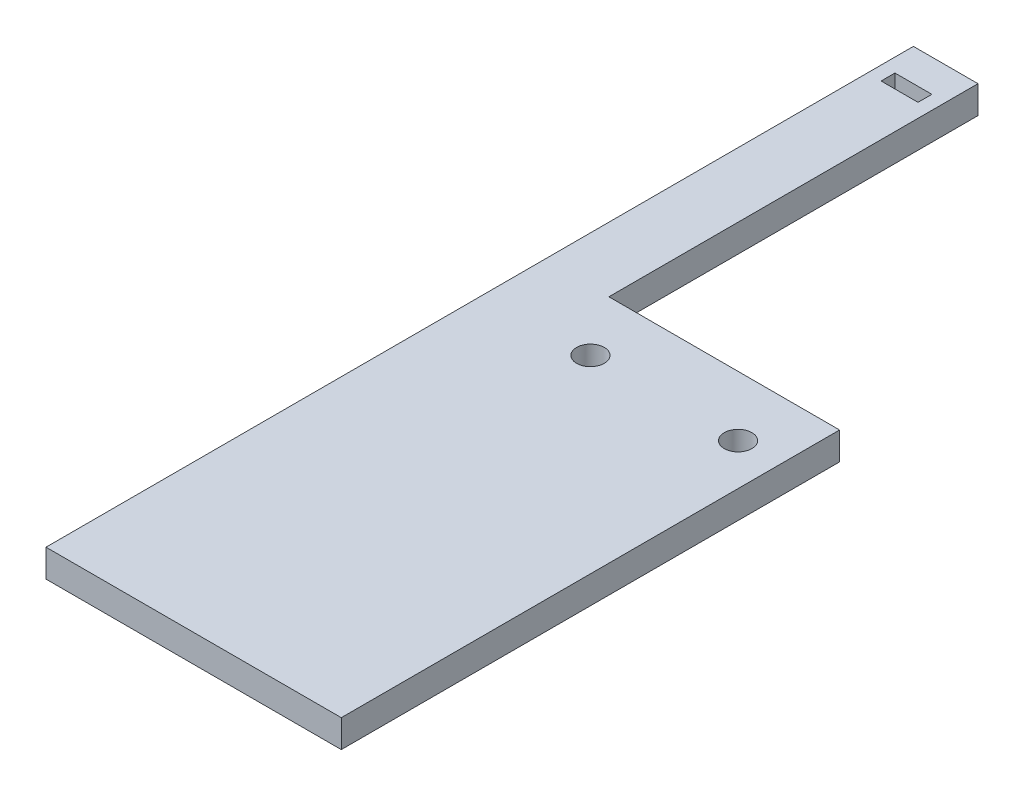
from build123d import *

# Parameters (mm, degrees)
SKETCH1_W           = 4
SKETCH1_H           = 1.5
BOSS_EXTRUDE1_DEPTH = 3
SKETCH3_W           = 12
SKETCH3_H           = 3
CUT_EXTRUDE2_DEPTH  = 104.831594421
SKETCH6_R           = 1.5
CUT_EXTRUDE4_DEPTH  = 10


with BuildPart() as part:
    # Sketch1 → Boss-Extrude1 (new body)
    with BuildSketch(Plane(origin=(0, 0, 0), x_dir=(1, 0, 0), z_dir=(0, 1, 0))):
        Polygon((0, 54), (0, 94), (7, 94), (7, 54), (44, 54), (44, 0), (0, 0), align=None)
        with Locations((3.5, 89.75)):
            Rectangle(SKETCH1_W, SKETCH1_H, mode=Mode.SUBTRACT)
    extrude(amount=BOSS_EXTRUDE1_DEPTH)

    # Sketch3 → Cut-Extrude2 (cut, through all)
    with BuildSketch(Plane.XY):
        with Locations((38, 1.5)):
            Rectangle(SKETCH3_W, SKETCH3_H)
    extrude(amount=-CUT_EXTRUDE2_DEPTH, mode=Mode.SUBTRACT)

    # Sketch6 → Cut-Extrude4 (cut)
    with BuildSketch(Plane(origin=(0, 3, 0), x_dir=(1, 0, 0), z_dir=(0, 1, 0))):
        with Locations(Location((11.5, 47.5, 0), (0, 0, 270))):
            Circle(SKETCH6_R)
        with Locations(Location((27.5, 47.5, 0), (0, 0, 270))):
            Circle(SKETCH6_R)
    extrude(amount=-CUT_EXTRUDE4_DEPTH, mode=Mode.SUBTRACT)


solid = part.part
